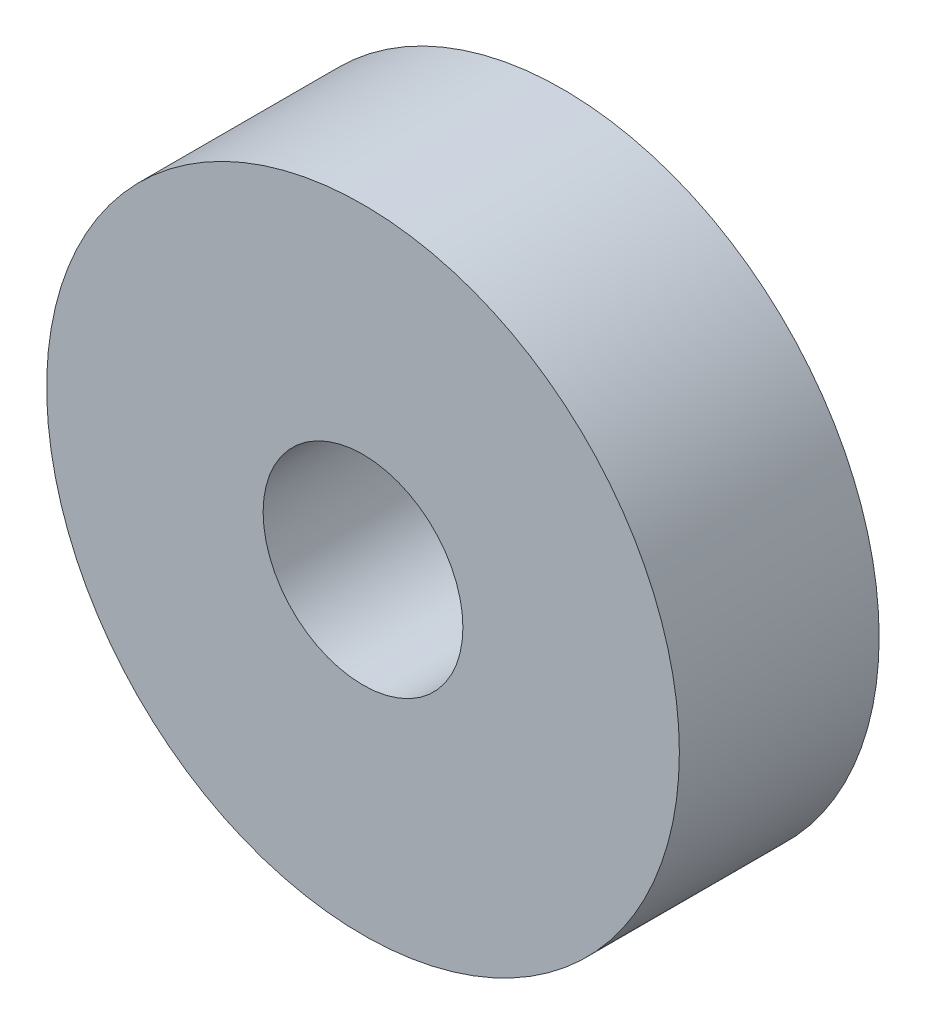
from build123d import *

# Parameters (mm, degrees)
CROQUIS1_R              = 9.5
CROQUIS1_R_2            = 3
SALIENTE_EXTRUIR1_DEPTH = 6


with BuildPart() as part:
    # Croquis1 → Saliente-Extruir1 (new body)
    with BuildSketch(Plane.XY):
        Circle(CROQUIS1_R)
        Circle(CROQUIS1_R_2, mode=Mode.SUBTRACT)
    extrude(amount=SALIENTE_EXTRUIR1_DEPTH)


solid = part.part
